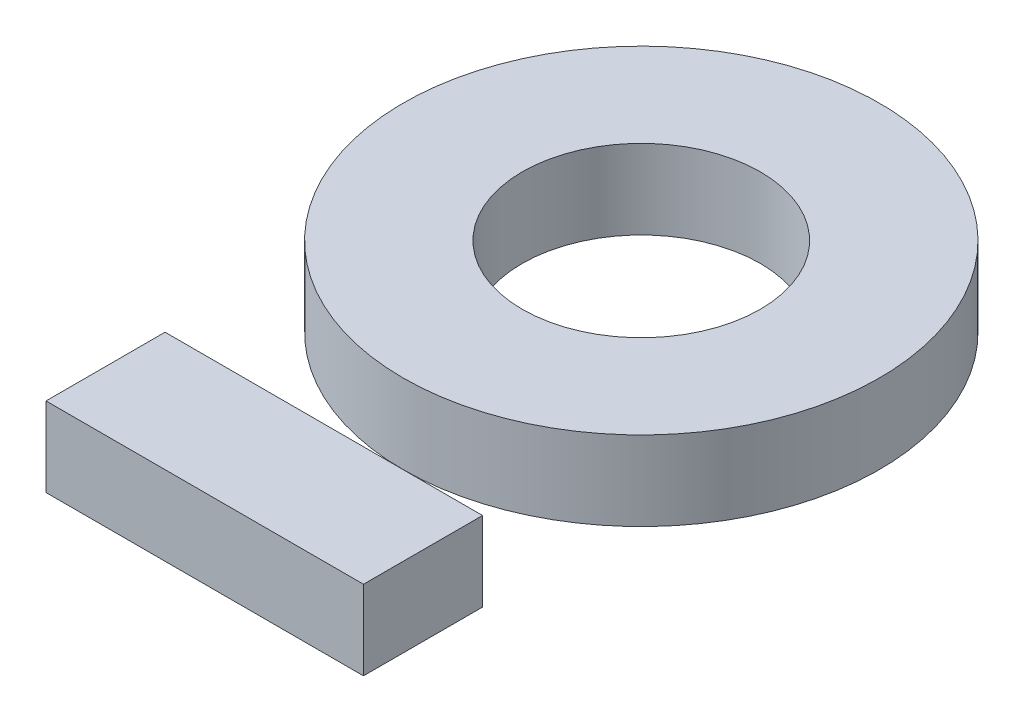
from build123d import *

# Parameters (mm, degrees)
SKETCH1_R             = 19.05
SKETCH1_R_2           = 9.525
BOSS_EXTRUDE1_DEPTH   = 6.35
SKETCH1_W             = 25.4
SKETCH1_H             = 9.525
BOSS_EXTRUDE1_2_DEPTH = 6.35


with BuildPart() as part:
    # Sketch1 → Boss-Extrude1 (new body)
    with BuildSketch(Plane(origin=(0, 0, 0), x_dir=(1, 0, 0), z_dir=(0, 1, 0))):
        with Locations(Location((0, 0, 0), (0, 0, 270))):
            Circle(SKETCH1_R)
        with Locations(Location((0, 0, 0), (0, 0, 270))):
            Circle(SKETCH1_R_2, mode=Mode.SUBTRACT)
    extrude(amount=BOSS_EXTRUDE1_DEPTH)


with BuildPart() as body_2:
    # Sketch1 → Boss-Extrude1 2 (new body)
    with BuildSketch(Plane(origin=(0, 0, 0), x_dir=(1, 0, 0), z_dir=(0, 1, 0))):
        with Locations((0, -30.1625)):
            Rectangle(SKETCH1_W, SKETCH1_H)
    extrude(amount=BOSS_EXTRUDE1_2_DEPTH)


solid = Compound([part.part, body_2.part])
